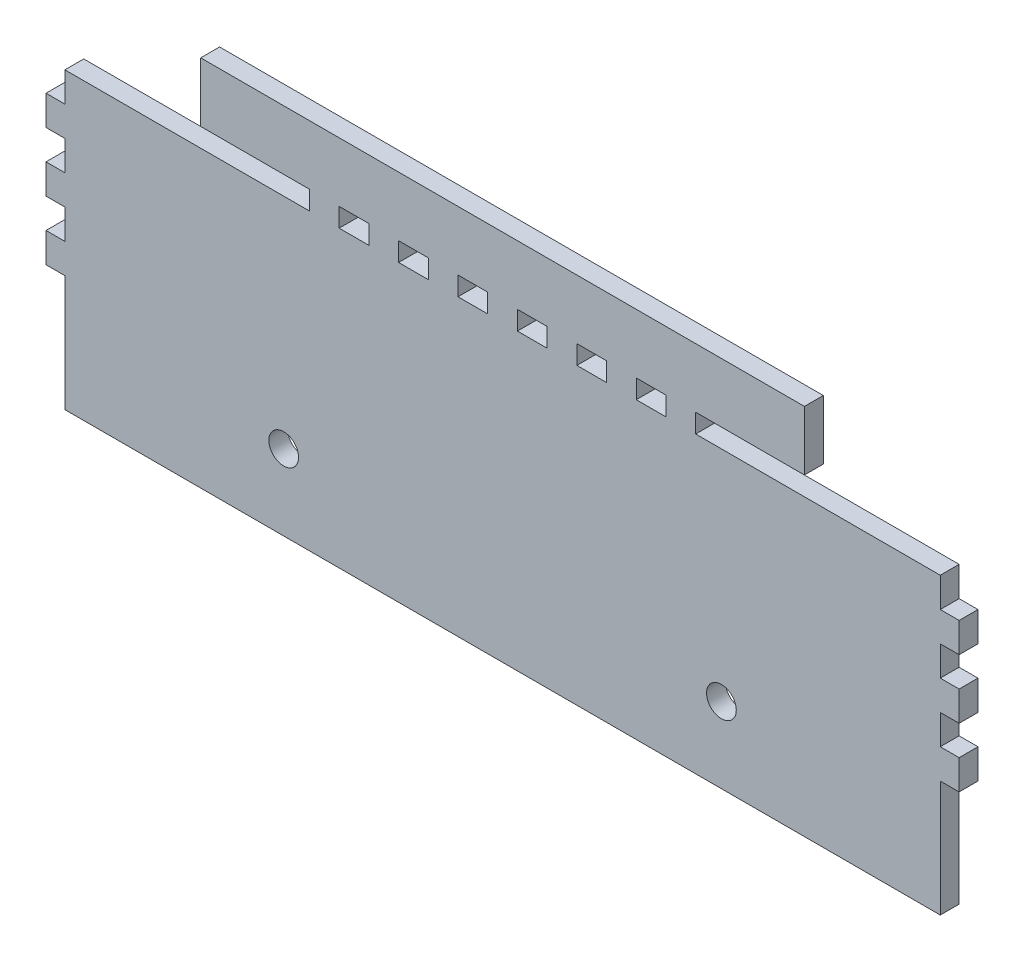
from build123d import *

# Parameters (mm, degrees)
SKETCH1_R           = 2.5
SKETCH1_W           = 5
SKETCH1_H           = 3.175
BOSS_EXTRUDE1_DEPTH = 3.175


with BuildPart() as part:
    # Sketch1 → Boss-Extrude1 (new body)
    with BuildSketch(Plane.XY):
        Polygon((-147.32, 0), (-106.16, 0), (-106.16, 3.175), (-124.46, 3.175), (-124.46, 13.175), (-22.86, 13.175), (-22.86, 3.175), (-41.16, 3.175), (-41.16, 0), (0, 0), (0, -5), (3.175, -5), (3.175, -10), (0, -10), (0, -15), (3.175, -15), (3.175, -20), (0, -20), (0, -25), (3.175, -25), (3.175, -30), (0, -30), (0, -49.53), (-147.32, -49.53), (-147.32, -30), (-150.495, -30), (-150.495, -25), (-147.32, -25), (-147.32, -20), (-150.495, -20), (-150.495, -15), (-147.32, -15), (-147.32, -10), (-150.495, -10), (-150.495, -5), (-147.32, -5), align=None)
        with Locations((-110.49, -36.83)):
            Circle(SKETCH1_R, mode=Mode.SUBTRACT)
        with Locations((-36.83, -36.83)):
            Circle(SKETCH1_R, mode=Mode.SUBTRACT)
        with Locations((-98.66, 1.5875)):
            Rectangle(SKETCH1_W, SKETCH1_H, mode=Mode.SUBTRACT)
        with Locations((-48.66, 1.5875)):
            Rectangle(SKETCH1_W, SKETCH1_H, mode=Mode.SUBTRACT)
        with Locations((-88.66, 1.5875)):
            Rectangle(SKETCH1_W, SKETCH1_H, mode=Mode.SUBTRACT)
        with Locations((-78.66, 1.5875)):
            Rectangle(SKETCH1_W, SKETCH1_H, mode=Mode.SUBTRACT)
        with Locations((-68.66, 1.5875)):
            Rectangle(SKETCH1_W, SKETCH1_H, mode=Mode.SUBTRACT)
        with Locations((-58.66, 1.5875)):
            Rectangle(SKETCH1_W, SKETCH1_H, mode=Mode.SUBTRACT)
    extrude(amount=BOSS_EXTRUDE1_DEPTH)


solid = part.part
